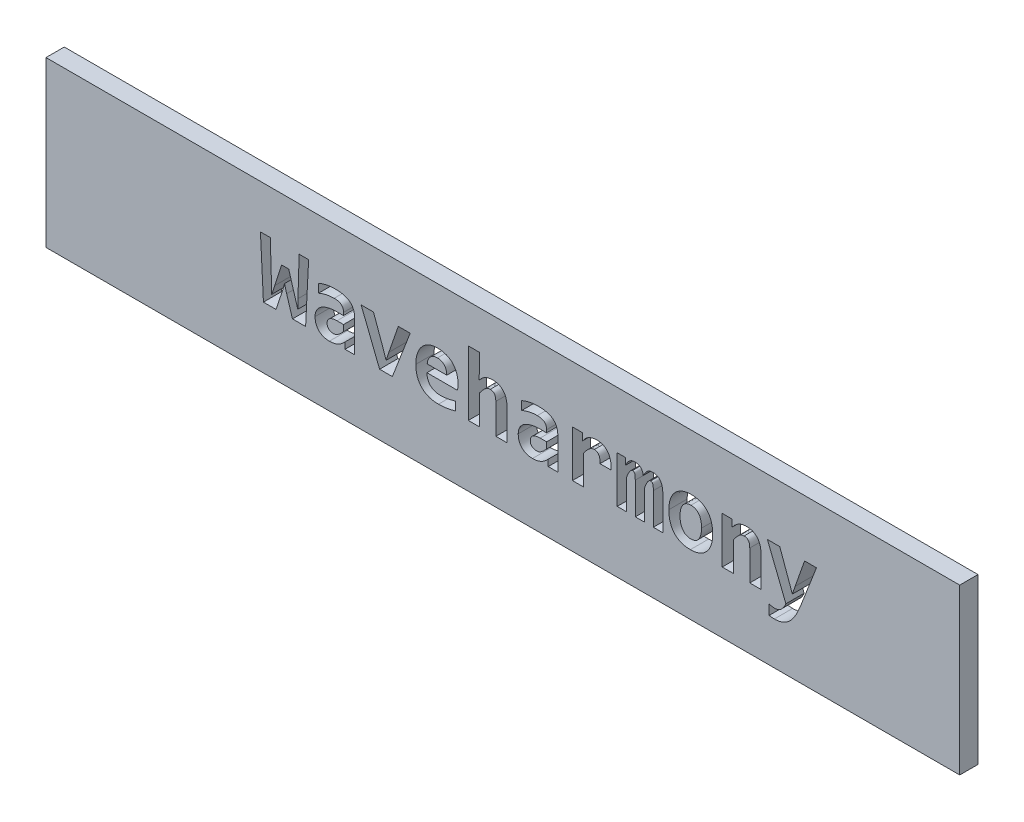
from build123d import *

# Parameters (mm, degrees)
SKETCH1_W           = 100
SKETCH1_H           = 18
BOSS_EXTRUDE1_DEPTH = 2
CUT_EXTRUDE1_DEPTH  = 2


with BuildPart() as part:
    # Sketch1 → Boss-Extrude1 (new body)
    with BuildSketch(Plane.XY):
        Rectangle(SKETCH1_W, SKETCH1_H)
    extrude(amount=BOSS_EXTRUDE1_DEPTH)

    # Sketch2 → Cut-Extrude1 (cut)
    # profile 1 of 11: a face of its own
    with BuildSketch(Plane.XY.offset(2)):
        Polygon((-21.587813536, -2.284890662), (-23.024407739, -2.284890662), (-23.663221145, -0.213898815), (-23.895784551, 0.629511512), (-24.140123319, -0.234505699), (-24.827510094, -2.284890662), (-26.203755565, -2.284890662), (-26.53346571, 4.215109338), (-25.454548138, 4.215109338), (-25.327962993, 0.048102997), (-25.295580746, -1.091163307), (-24.979117884, -0.110864394), (-24.207831652, 2.236848468), (-23.438017341, 2.236848468), (-22.685866072, -0.286022909), (-22.442999225, -1.080859865), (-22.426808101, -0.066706786), (-22.295807196, 4.215109338), (-21.258103391, 4.215109338), align=None)
    # profile 2 of 11: a face of its own
    with BuildSketch(Plane.XY.offset(2)):
        with BuildLine():
            Line((-17.269199406, -2.284890662), (-17.298637812, -1.61516693))
            add(Edge.make_bspline(
                [(-17.298637812, -1.61516693), (-17.351452018, -1.668846314), (-17.456720305, -1.775839055), (-17.62611479, -1.923633479), (-17.808206845, -2.056912646), (-18.007567405, -2.169080327), (-18.225570732, -2.259247172), (-18.461299031, -2.329439707), (-18.719577787, -2.370744059), (-18.898464373, -2.376239967), (-18.991346145, -2.379093561)],
                knots=[0, 0, 0, 0, 0.942751787, 1.87907519, 2.811864331, 3.763701556, 4.73586472, 5.760432521, 6.837168281, 8, 8, 8, 8], degree=3))
            add(Edge.make_bspline(
                [(-18.991346145, -2.379093561), (-19.053219082, -2.377601554), (-19.173884307, -2.374691826), (-19.348923144, -2.354461759), (-19.512660378, -2.319077971), (-19.664608269, -2.269142844), (-19.804343246, -2.205725689), (-19.93276168, -2.131498086), (-20.049059591, -2.045945001), (-20.154944448, -1.949868998), (-20.247018541, -1.841733772), (-20.329829424, -1.724945391), (-20.396477124, -1.59530188), (-20.454837748, -1.457017294), (-20.498134879, -1.30870534), (-20.528852434, -1.152521487), (-20.548699508, -0.989622268), (-20.550611634, -0.878283733), (-20.551581652, -0.821801894)],
                knots=[0, 0, 0, 0, 1.188820374, 2.318449472, 3.379888704, 4.402475042, 5.385577281, 6.32342832, 7.24738733, 8.154894716, 9.063967784, 9.97147517, 10.899274027, 11.85872107, 12.852031674, 13.861540196, 14.915163189, 16, 16, 16, 16], degree=3))
            add(Edge.make_bspline(
                [(-20.551581652, -0.821801894), (-20.550260247, -0.763260444), (-20.547655254, -0.647852984), (-20.515751564, -0.479451608), (-20.471276507, -0.316728977), (-20.404411778, -0.162020354), (-20.318227027, -0.01539808), (-20.214142102, 0.122201264), (-20.087623554, 0.246865644), (-19.943402219, 0.361908255), (-19.778314464, 0.464613133), (-19.595939435, 0.557536908), (-19.393636257, 0.636933519), (-19.172683768, 0.704171929), (-18.931854096, 0.759231501), (-18.670883228, 0.795916973), (-18.390290679, 0.82043638), (-18.196566245, 0.822657013), (-18.096418609, 0.82380499)],
                knots=[0, 0, 0, 0, 0.846334836, 1.668447797, 2.473381772, 3.284808262, 4.099802161, 4.930887555, 5.774685007, 6.664352488, 7.596475241, 8.584410062, 9.623785724, 10.738215398, 11.925463769, 13.196192477, 14.550545786, 16, 16, 16, 16], degree=3))
            Line((-18.096418609, 0.82380499), (-17.442886, 0.82380499))
            Line((-17.442886, 0.82380499), (-17.442886, 1.122604809))
            add(Edge.make_bspline(
                [(-17.442886, 1.122604809), (-17.445117476, 1.18320802), (-17.449420267, 1.300064731), (-17.491133289, 1.465973166), (-17.561623502, 1.613524408), (-17.650923172, 1.715044012), (-17.737883737, 1.780932573), (-17.811455069, 1.827590247), (-17.895815455, 1.864618589), (-17.988173641, 1.897464004), (-18.090348745, 1.92469543), (-18.203992326, 1.940572051), (-18.328190913, 1.953688828), (-18.414801606, 1.954050896), (-18.45998292, 1.954239772)],
                knots=[0, 0, 0, 0, 1.447721202, 2.79153421, 4.061974913, 5.326381525, 5.97912129, 6.669712629, 7.405140625, 8.177401359, 9.014479125, 9.929270305, 10.919783635, 12, 12, 12, 12], degree=3))
            add(Edge.make_bspline(
                [(-18.45998292, 1.954239772), (-18.533624448, 1.953235612), (-18.681157283, 1.951223885), (-18.901230959, 1.930933741), (-19.120578733, 1.900642706), (-19.409040536, 1.840637604), (-19.765872332, 1.745286472), (-20.038434724, 1.633395759), (-20.174770058, 1.577428178)],
                knots=[0, 0, 0, 0, 0.749590158, 1.5017228, 2.248461115, 3.002830009, 4.500819683, 6, 6, 6, 6], degree=3))
            Line((-20.174770058, 1.577428178), (-20.174770058, 2.519457164))
            add(Edge.make_bspline(
                [(-20.174770058, 2.519457164), (-20.112268594, 2.546230956), (-19.98427608, 2.60105919), (-19.781233084, 2.670617626), (-19.5655734, 2.736007315), (-19.33637827, 2.790881745), (-19.098501166, 2.838423593), (-18.853800481, 2.872452895), (-18.604529956, 2.891306366), (-18.436952653, 2.89460634), (-18.352532739, 2.896268758)],
                knots=[0, 0, 0, 0, 0.870643359, 1.78293153, 2.747244943, 3.756289436, 4.800212086, 5.853400504, 6.918614031, 8, 8, 8, 8], degree=3))
            add(Edge.make_bspline(
                [(-18.352532739, 2.896268758), (-18.262226113, 2.894679263), (-18.088271295, 2.89161747), (-17.836932485, 2.873268427), (-17.605746022, 2.839714782), (-17.393577641, 2.79274324), (-17.200205594, 2.73300098), (-17.02429921, 2.659170096), (-16.866843273, 2.571154064), (-16.726445381, 2.469987431), (-16.603291724, 2.356275314), (-16.497224294, 2.22841685), (-16.410465285, 2.085559887), (-16.339339651, 1.929917132), (-16.285415586, 1.760713839), (-16.245479628, 1.578494727), (-16.221936987, 1.382773084), (-16.219498941, 1.247782605), (-16.218248319, 1.17853778)],
                knots=[0, 0, 0, 0, 1.377759711, 2.653935252, 3.841633143, 4.938469235, 5.965914915, 6.92517161, 7.843396777, 8.711792949, 9.559226208, 10.39396998, 11.237393933, 12.101553923, 12.998669062, 13.941252007, 14.943942973, 16, 16, 16, 16], degree=3))
            Line((-16.218248319, 1.17853778), (-16.218248319, -2.284890662))
            Line((-16.218248319, -2.284890662), (-17.269199406, -2.284890662))
        make_face()
        with BuildLine():
            Line((-17.442886, -0.024021097), (-18.15235158, -0.024021097))
            add(Edge.make_bspline(
                [(-18.15235158, -0.024021097), (-18.199454486, -0.025160611), (-18.290339198, -0.027359294), (-18.421513086, -0.035892563), (-18.541204408, -0.057761637), (-18.650073709, -0.083509334), (-18.748897102, -0.115844723), (-18.83669797, -0.15574051), (-18.915971397, -0.199938492), (-19.006641327, -0.265154456), (-19.099128469, -0.361669291), (-19.178988621, -0.494472513), (-19.224474309, -0.641302171), (-19.229959336, -0.742508508), (-19.232741072, -0.793835409)],
                knots=[0, 0, 0, 0, 1.1346769, 2.18935077, 3.160455313, 4.060166297, 4.882052532, 5.659342063, 6.378819937, 7.064121245, 8.342468752, 9.566207994, 10.765699828, 12, 12, 12, 12], degree=3))
            add(Edge.make_bspline(
                [(-19.232741072, -0.793835409), (-19.230681756, -0.843111116), (-19.226750035, -0.937190042), (-19.191554696, -1.069905166), (-19.129830281, -1.182988214), (-19.045171415, -1.276936569), (-18.939065539, -1.348765651), (-18.815603584, -1.400882007), (-18.674923493, -1.431929436), (-18.575447769, -1.435297906), (-18.523275493, -1.437064575)],
                knots=[0, 0, 0, 0, 1.086697673, 2.074761695, 3.000659932, 3.905665256, 4.840141479, 5.805924735, 6.849267962, 8, 8, 8, 8], degree=3))
            add(Edge.make_bspline(
                [(-18.523275493, -1.437064575), (-18.482298101, -1.434710513), (-18.397916351, -1.429862966), (-18.271711857, -1.391240762), (-18.142157455, -1.33404858), (-18.012486333, -1.248839413), (-17.878998501, -1.142892279), (-17.737353681, -1.019264277), (-17.59015715, -0.874565064), (-17.493389032, -0.768325794), (-17.442886, -0.712879793)],
                knots=[0, 0, 0, 0, 0.735319699, 1.514190145, 2.354950119, 3.274773688, 4.292602642, 5.417493931, 6.652196731, 8, 8, 8, 8], degree=3))
            Line((-17.442886, -0.712879793), (-17.442886, -0.024021097))
        make_face(mode=Mode.SUBTRACT)
    # profile 3 of 11: a face of its own
    with BuildSketch(Plane.XY.offset(2)):
        Polygon((-12.093927667, -2.284890662), (-13.489308101, -2.284890662), (-15.51172658, 2.802065859), (-14.160503754, 2.802065859), (-13.097777304, -0.135887039), (-12.779842522, -1.083803706), (-12.478098862, -0.175628887), (-11.443338899, 2.802065859), (-10.142161362, 2.802065859), align=None)
    # profile 4 of 11: a face of its own
    with BuildSketch(Plane.XY.offset(2)):
        with BuildLine():
            add(Edge.make_bspline(
                [(-4.913900493, 0.666309519), (-4.914152692, 0.619202447), (-4.914725548, 0.512201219), (-4.92153346, 0.341483685), (-4.928107492, 0.15824209), (-4.939373307, 0.035311886), (-4.944810819, -0.024021097)],
                knots=[0, 0, 0, 0, 0.817723831, 1.857416531, 2.965869532, 4, 4, 4, 4], degree=3))
            Line((-4.944810819, -0.024021097), (-8.305204841, -0.024021097))
            add(Edge.make_bspline(
                [(-8.305204841, -0.024021097), (-8.304481883, -0.080045003), (-8.303074998, -0.189068328), (-8.280454883, -0.346767819), (-8.251478725, -0.495328752), (-8.205333905, -0.63231827), (-8.147034089, -0.758501764), (-8.08006244, -0.875098402), (-8.001153615, -0.980529041), (-7.91227442, -1.075247288), (-7.813536191, -1.159990439), (-7.703142428, -1.231436741), (-7.585717013, -1.295742357), (-7.457904186, -1.346545341), (-7.322840118, -1.388645887), (-7.179475998, -1.415104903), (-7.029556261, -1.434103831), (-6.927062102, -1.4360609), (-6.874498319, -1.437064575)],
                knots=[0, 0, 0, 0, 1.179290589, 2.294916396, 3.351295625, 4.364764696, 5.331602319, 6.276694144, 7.192669172, 8.099614974, 9.009032183, 9.926581103, 10.865546218, 11.825449834, 12.819647447, 13.841518478, 14.893030041, 16, 16, 16, 16], degree=3))
            add(Edge.make_bspline(
                [(-6.874498319, -1.437064575), (-6.745806527, -1.433825622), (-6.479180388, -1.427115096), (-6.142138262, -1.383196902), (-5.861376103, -1.333867673), (-5.642693007, -1.285202964), (-5.420659469, -1.224286153), (-5.271935679, -1.177953742), (-5.196509188, -1.15445588)],
                knots=[0, 0, 0, 0, 1.355541314, 2.808436665, 3.575023574, 4.358862549, 5.167683667, 6, 6, 6, 6], degree=3))
            Line((-5.196509188, -1.15445588), (-5.196509188, -2.096484865))
            add(Edge.make_bspline(
                [(-5.196509188, -2.096484865), (-5.264059726, -2.116674927), (-5.404702325, -2.158711348), (-5.624293956, -2.212104517), (-5.855513944, -2.257638753), (-6.092240303, -2.301151825), (-6.333144068, -2.336918894), (-6.575302851, -2.36124457), (-6.814925598, -2.376767615), (-6.973094128, -2.378325136), (-7.051128754, -2.379093561)],
                knots=[0, 0, 0, 0, 0.898776519, 1.871284374, 2.879703842, 3.90303, 4.9398418, 5.983668506, 7.005215048, 8, 8, 8, 8], degree=3))
            add(Edge.make_bspline(
                [(-7.051128754, -2.379093561), (-7.145433683, -2.377292945), (-7.329177594, -2.373784621), (-7.597274323, -2.341310133), (-7.851039404, -2.29312305), (-8.089101126, -2.220442988), (-8.310642526, -2.127884914), (-8.515352122, -2.015230444), (-8.703300706, -1.883949718), (-8.873680161, -1.733238129), (-9.025175367, -1.562085507), (-9.157503376, -1.371638085), (-9.271509591, -1.162418961), (-9.365953516, -0.934577491), (-9.439093706, -0.687808655), (-9.491557966, -0.42274398), (-9.524798306, -0.139184891), (-9.528128064, 0.056347525), (-9.529842522, 0.157025099)],
                knots=[0, 0, 0, 0, 1.121620277, 2.185367166, 3.208914926, 4.191382306, 5.14116652, 6.060889567, 6.966233761, 7.863618855, 8.76100395, 9.679262128, 10.617148408, 11.590729859, 12.60841723, 13.674324534, 14.802534302, 16, 16, 16, 16], degree=3))
            add(Edge.make_bspline(
                [(-9.529842522, 0.157025099), (-9.528091614, 0.257700492), (-9.52466562, 0.45469169), (-9.491212783, 0.742596956), (-9.438513083, 1.016314066), (-9.365613344, 1.275753801), (-9.270666627, 1.519102184), (-9.159740983, 1.745691122), (-9.030414217, 1.954589075), (-8.883025356, 2.144100565), (-8.719937307, 2.316796264), (-8.536750387, 2.464927712), (-8.340480027, 2.596819111), (-8.125502405, 2.703068035), (-7.89740549, 2.791185938), (-7.654740225, 2.85218151), (-7.399715523, 2.890253609), (-7.22544453, 2.89423615), (-7.13650013, 2.896268758)],
                knots=[0, 0, 0, 0, 1.180034156, 2.308968792, 3.393220884, 4.44579929, 5.46393457, 6.451895544, 7.400149152, 8.339143413, 9.262785816, 10.178384736, 11.095843329, 12.029766064, 12.983882541, 13.957808115, 14.957706464, 16, 16, 16, 16], degree=3))
            add(Edge.make_bspline(
                [(-7.13650013, 2.896268758), (-7.049081503, 2.894345589), (-6.878577537, 2.890594583), (-6.63044303, 2.859860631), (-6.398495213, 2.806534101), (-6.181775162, 2.734576401), (-5.982257901, 2.642877637), (-5.79749654, 2.537326807), (-5.631740442, 2.41232747), (-5.482545202, 2.271842791), (-5.349245478, 2.116796377), (-5.233739187, 1.946394882), (-5.136929473, 1.761212205), (-5.055724286, 1.563739738), (-4.992653664, 1.354133784), (-4.947420409, 1.133959045), (-4.918320462, 0.903576111), (-4.915391975, 0.746373157), (-4.913900493, 0.666309519)],
                knots=[0, 0, 0, 0, 1.178593255, 2.298764342, 3.364464973, 4.383380692, 5.372275211, 6.320955639, 7.247223129, 8.164610705, 9.079585451, 9.998951109, 10.93417802, 11.892522129, 12.874152535, 13.88107589, 14.920829619, 16, 16, 16, 16], degree=3))
        make_face()
        with BuildLine():
            add(Edge.make_bspline(
                [(-6.138538174, 0.82380499), (-6.138759995, 0.87044271), (-6.139188318, 0.960497414), (-6.152184426, 1.09121633), (-6.177271706, 1.212463675), (-6.212734605, 1.324738923), (-6.256643746, 1.427803775), (-6.308659852, 1.521372132), (-6.367172098, 1.605862746), (-6.434219537, 1.679683969), (-6.507198219, 1.745309043), (-6.585934786, 1.802419273), (-6.671012761, 1.850117828), (-6.791986671, 1.900987019), (-6.955327315, 1.946198024), (-7.091017163, 1.951528059), (-7.160050855, 1.954239772)],
                knots=[0, 0, 0, 0, 1.134846417, 2.191321935, 3.191481249, 4.143340004, 5.052899811, 5.913632381, 6.745287675, 7.548677924, 8.335201916, 9.130741839, 9.911440996, 10.703386864, 12.32281206, 14, 14, 14, 14], degree=3))
            add(Edge.make_bspline(
                [(-7.160050855, 1.954239772), (-7.198384499, 1.953614093), (-7.273389408, 1.952389867), (-7.382476475, 1.936316816), (-7.486798798, 1.9151484), (-7.586076448, 1.882527258), (-7.679613078, 1.839358684), (-7.769392367, 1.789753142), (-7.851818296, 1.728171709), (-7.956653347, 1.635927698), (-8.071499479, 1.497337347), (-8.174345983, 1.299121128), (-8.251584906, 1.072968071), (-8.273268829, 0.909310579), (-8.284597957, 0.82380499)],
                knots=[0, 0, 0, 0, 0.778791991, 1.523810857, 2.23806509, 2.941647734, 3.642679102, 4.330739894, 5.023199128, 5.729957914, 7.168361981, 8.650260572, 10.249872714, 12, 12, 12, 12], degree=3))
            Line((-8.284597957, 0.82380499), (-6.138538174, 0.82380499))
        make_face(mode=Mode.SUBTRACT)
    # profile 5 of 11: a face of its own
    with BuildSketch(Plane.XY.offset(2)):
        with BuildLine():
            Line((-0.768972957, -2.284890662), (-0.768972957, 1.02545807))
            add(Edge.make_bspline(
                [(-0.768972957, 1.02545807), (-0.770974521, 1.090805814), (-0.7747278, 1.213344082), (-0.801409345, 1.385238291), (-0.849258502, 1.530792764), (-0.915920356, 1.652192248), (-1.005318698, 1.746141073), (-1.113813324, 1.814341593), (-1.24285389, 1.853258774), (-1.334410625, 1.85769435), (-1.382763717, 1.860036874)],
                knots=[0, 0, 0, 0, 1.330337845, 2.494612452, 3.527515131, 4.435664575, 5.29056087, 6.138661007, 7.016986611, 8, 8, 8, 8], degree=3))
            add(Edge.make_bspline(
                [(-1.382763717, 1.860036874), (-1.433621911, 1.856669733), (-1.535882831, 1.849899398), (-1.687486099, 1.801512875), (-1.833237608, 1.720141707), (-1.975752342, 1.608561189), (-2.114808998, 1.46938508), (-2.262409591, 1.312145662), (-2.409286974, 1.128380589), (-2.507655389, 0.997742849), (-2.558828029, 0.929783251)],
                knots=[0, 0, 0, 0, 0.785464114, 1.579338109, 2.434441881, 3.353550729, 4.367060634, 5.472426257, 6.685120424, 8, 8, 8, 8], degree=3))
            Line((-2.558828029, 0.929783251), (-2.558828029, -2.284890662))
            Line((-2.558828029, -2.284890662), (-3.78346571, -2.284890662))
            Line((-3.78346571, -2.284890662), (-3.78346571, 4.780326729))
            Line((-3.78346571, 4.780326729), (-2.558828029, 4.780326729))
            Line((-2.558828029, 4.780326729), (-2.558828029, 3.036101185))
            Line((-2.558828029, 3.036101185), (-2.619176761, 2.113207164))
            add(Edge.make_bspline(
                [(-2.619176761, 2.113207164), (-2.567853881, 2.172214398), (-2.468025699, 2.286989422), (-2.309840964, 2.445355045), (-2.143133416, 2.582683398), (-1.963229523, 2.695610445), (-1.770157877, 2.785322231), (-1.560566608, 2.848351679), (-1.332867816, 2.889729142), (-1.173946195, 2.894031816), (-1.0913235, 2.896268758)],
                knots=[0, 0, 0, 0, 1.052065119, 2.046372823, 3.008332997, 3.951627659, 4.896837736, 5.863678464, 6.889335241, 8, 8, 8, 8], degree=3))
            add(Edge.make_bspline(
                [(-1.0913235, 2.896268758), (-1.028412933, 2.895261569), (-0.906466428, 2.893309223), (-0.730204644, 2.866659797), (-0.565851344, 2.828423593), (-0.414928484, 2.771232137), (-0.275035297, 2.702417903), (-0.148564736, 2.618051866), (-0.033190773, 2.521081609), (0.069561186, 2.410442341), (0.160636151, 2.287669409), (0.242018043, 2.154001066), (0.30672954, 2.00636172), (0.361508219, 1.848375018), (0.403879946, 1.679894342), (0.434824099, 1.501849768), (0.45240669, 1.313820711), (0.454560889, 1.185443072), (0.455664725, 1.119660968)],
                knots=[0, 0, 0, 0, 1.128292418, 2.187093889, 3.193297493, 4.152042544, 5.077728068, 5.986496946, 6.874059951, 7.777692081, 8.690209529, 9.614679004, 10.580558963, 11.577778426, 12.613878209, 13.695586306, 14.819193276, 16, 16, 16, 16], degree=3))
            Line((0.455664725, 1.119660968), (0.455664725, -2.284890662))
            Line((0.455664725, -2.284890662), (-0.768972957, -2.284890662))
        make_face()
    # profile 6 of 11: a face of its own
    with BuildSketch(Plane.XY.offset(2)):
        with BuildLine():
            Line((4.962684652, -2.284890662), (4.933246246, -1.61516693))
            add(Edge.make_bspline(
                [(4.933246246, -1.61516693), (4.88043204, -1.668846314), (4.775163753, -1.775839055), (4.605769268, -1.923633479), (4.423677213, -2.056912646), (4.224316653, -2.169080327), (4.006313325, -2.259247172), (3.770585027, -2.329439707), (3.512306271, -2.370744059), (3.333419685, -2.376239967), (3.240537913, -2.379093561)],
                knots=[0, 0, 0, 0, 0.942751787, 1.87907519, 2.811864331, 3.763701556, 4.73586472, 5.760432521, 6.837168281, 8, 8, 8, 8], degree=3))
            add(Edge.make_bspline(
                [(3.240537913, -2.379093561), (3.178664976, -2.377601554), (3.057999751, -2.374691826), (2.882960914, -2.354461759), (2.71922368, -2.319077971), (2.567275789, -2.269142844), (2.427540811, -2.205725689), (2.299122378, -2.131498086), (2.182824467, -2.045945001), (2.07693961, -1.949868998), (1.984865517, -1.841733772), (1.902054634, -1.724945391), (1.835406934, -1.59530188), (1.77704631, -1.457017294), (1.733749179, -1.30870534), (1.703031624, -1.152521487), (1.68318455, -0.989622268), (1.681272424, -0.878283733), (1.680302406, -0.821801894)],
                knots=[0, 0, 0, 0, 1.188820374, 2.318449472, 3.379888704, 4.402475042, 5.385577281, 6.32342832, 7.24738733, 8.154894716, 9.063967784, 9.97147517, 10.899274027, 11.85872107, 12.852031674, 13.861540196, 14.915163189, 16, 16, 16, 16], degree=3))
            add(Edge.make_bspline(
                [(1.680302406, -0.821801894), (1.681623811, -0.763260444), (1.684228804, -0.647852984), (1.716132494, -0.479451608), (1.760607551, -0.316728977), (1.82747228, -0.162020354), (1.913657031, -0.01539808), (2.017741956, 0.122201264), (2.144260504, 0.246865644), (2.288481839, 0.361908255), (2.453569594, 0.464613133), (2.635944623, 0.557536908), (2.838247801, 0.636933519), (3.05920029, 0.704171929), (3.300029962, 0.759231501), (3.56100083, 0.795916973), (3.841593379, 0.82043638), (4.035317813, 0.822657013), (4.135465449, 0.82380499)],
                knots=[0, 0, 0, 0, 0.846334836, 1.668447797, 2.473381772, 3.284808262, 4.099802161, 4.930887555, 5.774685007, 6.664352488, 7.596475241, 8.584410062, 9.623785724, 10.738215398, 11.925463769, 13.196192477, 14.550545786, 16, 16, 16, 16], degree=3))
            Line((4.135465449, 0.82380499), (4.788998058, 0.82380499))
            Line((4.788998058, 0.82380499), (4.788998058, 1.122604809))
            add(Edge.make_bspline(
                [(4.788998058, 1.122604809), (4.786766582, 1.18320802), (4.782463791, 1.300064731), (4.740750769, 1.465973166), (4.670260556, 1.613524408), (4.580960886, 1.715044012), (4.494000321, 1.780932573), (4.420428989, 1.827590247), (4.336068603, 1.864618589), (4.243710417, 1.897464004), (4.141535313, 1.92469543), (4.027891732, 1.940572051), (3.903693145, 1.953688828), (3.817082452, 1.954050896), (3.771901138, 1.954239772)],
                knots=[0, 0, 0, 0, 1.447721202, 2.79153421, 4.061974913, 5.326381525, 5.97912129, 6.669712629, 7.405140625, 8.177401359, 9.014479125, 9.929270305, 10.919783635, 12, 12, 12, 12], degree=3))
            add(Edge.make_bspline(
                [(3.771901138, 1.954239772), (3.69825961, 1.953235612), (3.550726775, 1.951223885), (3.330653099, 1.930933741), (3.111305325, 1.900642706), (2.822843522, 1.840637604), (2.466011726, 1.745286472), (2.193449334, 1.633395759), (2.057114, 1.577428178)],
                knots=[0, 0, 0, 0, 0.749590158, 1.5017228, 2.248461115, 3.002830009, 4.500819683, 6, 6, 6, 6], degree=3))
            Line((2.057114, 1.577428178), (2.057114, 2.519457164))
            add(Edge.make_bspline(
                [(2.057114, 2.519457164), (2.119615464, 2.546230956), (2.247607978, 2.60105919), (2.450650974, 2.670617626), (2.666310658, 2.736007315), (2.895505788, 2.790881745), (3.133382892, 2.838423593), (3.378083577, 2.872452895), (3.627354102, 2.891306366), (3.794931405, 2.89460634), (3.879351319, 2.896268758)],
                knots=[0, 0, 0, 0, 0.870643359, 1.78293153, 2.747244943, 3.756289436, 4.800212086, 5.853400504, 6.918614031, 8, 8, 8, 8], degree=3))
            add(Edge.make_bspline(
                [(3.879351319, 2.896268758), (3.969657945, 2.894679263), (4.143612763, 2.89161747), (4.394951573, 2.873268427), (4.626138036, 2.839714782), (4.838306417, 2.79274324), (5.031678464, 2.73300098), (5.207584848, 2.659170096), (5.365040785, 2.571154064), (5.505438677, 2.469987431), (5.628592334, 2.356275314), (5.734659764, 2.22841685), (5.821418773, 2.085559887), (5.892544407, 1.929917132), (5.946468472, 1.760713839), (5.98640443, 1.578494727), (6.009947071, 1.382773084), (6.012385117, 1.247782605), (6.013635739, 1.17853778)],
                knots=[0, 0, 0, 0, 1.377759711, 2.653935252, 3.841633143, 4.938469235, 5.965914915, 6.92517161, 7.843396777, 8.711792949, 9.559226208, 10.39396998, 11.237393933, 12.101553923, 12.998669062, 13.941252007, 14.943942973, 16, 16, 16, 16], degree=3))
            Line((6.013635739, 1.17853778), (6.013635739, -2.284890662))
            Line((6.013635739, -2.284890662), (4.962684652, -2.284890662))
        make_face()
        with BuildLine():
            Line((4.788998058, -0.024021097), (4.079532478, -0.024021097))
            add(Edge.make_bspline(
                [(4.079532478, -0.024021097), (4.032429572, -0.025160611), (3.94154486, -0.027359294), (3.810370972, -0.035892563), (3.69067965, -0.057761637), (3.581810349, -0.083509334), (3.482986956, -0.115844723), (3.395186088, -0.15574051), (3.315912661, -0.199938492), (3.225242731, -0.265154456), (3.132755589, -0.361669291), (3.052895437, -0.494472513), (3.007409749, -0.641302171), (3.001924722, -0.742508508), (2.999142986, -0.793835409)],
                knots=[0, 0, 0, 0, 1.1346769, 2.18935077, 3.160455313, 4.060166297, 4.882052532, 5.659342063, 6.378819937, 7.064121245, 8.342468752, 9.566207994, 10.765699828, 12, 12, 12, 12], degree=3))
            add(Edge.make_bspline(
                [(2.999142986, -0.793835409), (3.001202302, -0.843111116), (3.005134023, -0.937190042), (3.040329362, -1.069905166), (3.102053777, -1.182988214), (3.186712643, -1.276936569), (3.292818519, -1.348765651), (3.416280474, -1.400882007), (3.556960565, -1.431929436), (3.656436289, -1.435297906), (3.708608565, -1.437064575)],
                knots=[0, 0, 0, 0, 1.086697673, 2.074761695, 3.000659932, 3.905665256, 4.840141479, 5.805924735, 6.849267962, 8, 8, 8, 8], degree=3))
            add(Edge.make_bspline(
                [(3.708608565, -1.437064575), (3.749585957, -1.434710513), (3.833967707, -1.429862966), (3.960172201, -1.391240762), (4.089726603, -1.33404858), (4.219397724, -1.248839413), (4.352885557, -1.142892279), (4.494530377, -1.019264277), (4.641726908, -0.874565064), (4.738495026, -0.768325794), (4.788998058, -0.712879793)],
                knots=[0, 0, 0, 0, 0.735319699, 1.514190145, 2.354950119, 3.274773688, 4.292602642, 5.417493931, 6.652196731, 8, 8, 8, 8], degree=3))
            Line((4.788998058, -0.712879793), (4.788998058, -0.024021097))
        make_face(mode=Mode.SUBTRACT)
    # profile 7 of 11: a face of its own
    with BuildSketch(Plane.XY.offset(2)):
        with BuildLine():
            add(Edge.make_bspline(
                [(10.629577768, 0.82380499), (10.630329574, 0.868449404), (10.63176725, 0.953822808), (10.629705572, 1.077186508), (10.619501224, 1.189811969), (10.598250684, 1.321724532), (10.562933911, 1.467512371), (10.492189992, 1.614532609), (10.400829964, 1.72965893), (10.286018922, 1.806253455), (10.154634783, 1.852677436), (10.061325384, 1.857520492), (10.012843167, 1.860036874)],
                knots=[0, 0, 0, 0, 0.976776958, 1.86788822, 2.697749972, 3.447690252, 4.791052046, 5.96229558, 6.991616706, 7.96508575, 8.942687937, 10, 10, 10, 10], degree=3))
            add(Edge.make_bspline(
                [(10.012843167, 1.860036874), (9.967908399, 1.857426208), (9.875247928, 1.852042725), (9.736636801, 1.807797451), (9.597449076, 1.736518127), (9.453692485, 1.63966404), (9.309210655, 1.507384634), (9.155388351, 1.345163435), (8.997308597, 1.144902759), (8.894320682, 0.996619001), (8.839722696, 0.918007888)],
                knots=[0, 0, 0, 0, 0.690160971, 1.42318841, 2.216380134, 3.091386283, 4.08043663, 5.222959024, 6.527780232, 8, 8, 8, 8], degree=3))
            Line((8.839722696, 0.918007888), (8.839722696, -2.284890662))
            Line((8.839722696, -2.284890662), (7.615085014, -2.284890662))
            Line((7.615085014, -2.284890662), (7.615085014, 2.802065859))
            Line((7.615085014, 2.802065859), (8.696946428, 2.802065859))
            Line((8.696946428, 2.802065859), (8.741104036, 2.048442671))
            add(Edge.make_bspline(
                [(8.741104036, 2.048442671), (8.783968874, 2.110753685), (8.868618055, 2.233805037), (9.017207576, 2.39996838), (9.182802577, 2.545545499), (9.367434967, 2.668473608), (9.570115383, 2.770647072), (9.795730212, 2.841545663), (10.041757787, 2.889282312), (10.213762103, 2.893885575), (10.302811464, 2.896268758)],
                knots=[0, 0, 0, 0, 0.974824238, 1.925076027, 2.866944946, 3.811298368, 4.779277887, 5.783987857, 6.852735393, 8, 8, 8, 8], degree=3))
            add(Edge.make_bspline(
                [(10.302811464, 2.896268758), (10.364685354, 2.894347865), (10.484968699, 2.890613635), (10.660639841, 2.868108797), (10.824379311, 2.824084274), (10.978555231, 2.767592491), (11.121207927, 2.692957176), (11.252353445, 2.603289723), (11.372146683, 2.49748176), (11.477598344, 2.374266539), (11.572813887, 2.23665199), (11.654066319, 2.081920234), (11.721275116, 1.910472167), (11.775531668, 1.722683814), (11.816112482, 1.519290036), (11.844086098, 1.300960305), (11.857015517, 1.067316747), (11.855169012, 0.906732908), (11.854215449, 0.82380499)],
                knots=[0, 0, 0, 0, 1.004676022, 1.953098346, 2.866842467, 3.75148626, 4.613577702, 5.472942283, 6.324856067, 7.199983409, 8.099136356, 9.036153176, 10.030037521, 11.083594088, 12.205103978, 13.393537797, 14.653983583, 16, 16, 16, 16], degree=3))
            Line((11.854215449, 0.82380499), (10.629577768, 0.82380499))
        make_face()
    # profile 8 of 11: a face of its own
    with BuildSketch(Plane.XY.offset(2)):
        with BuildLine():
            Line((16.470157478, -2.284890662), (16.470157478, 1.190313142))
            add(Edge.make_bspline(
                [(16.470157478, 1.190313142), (16.469511995, 1.250180542), (16.468310418, 1.361624619), (16.461767756, 1.516876449), (16.448633409, 1.648749097), (16.424625645, 1.757544049), (16.389748706, 1.84537017), (16.335184781, 1.908903301), (16.261337143, 1.950091329), (16.204829778, 1.952784681), (16.1743015, 1.954239772)],
                knots=[0, 0, 0, 0, 1.57207779, 2.926446748, 4.080351894, 5.046061874, 5.847990396, 6.532792488, 7.207336622, 8, 8, 8, 8], degree=3))
            add(Edge.make_bspline(
                [(16.1743015, 1.954239772), (16.148319556, 1.951455397), (16.093490925, 1.945579644), (16.014932967, 1.900822835), (15.93811981, 1.832590886), (15.860760022, 1.736808767), (15.782558779, 1.609802132), (15.700643962, 1.448058864), (15.615176861, 1.249239336), (15.558549628, 1.103663787), (15.528128493, 1.02545807)],
                knots=[0, 0, 0, 0, 0.526386392, 1.110811622, 1.796736747, 2.611539741, 3.602236173, 4.824552589, 6.294094422, 8, 8, 8, 8], degree=3))
            Line((15.528128493, 1.02545807), (15.528128493, -2.284890662))
            Line((15.528128493, -2.284890662), (14.491896609, -2.284890662))
            Line((14.491896609, -2.284890662), (14.491896609, 1.190313142))
            add(Edge.make_bspline(
                [(14.491896609, 1.190313142), (14.491252463, 1.250181618), (14.490053375, 1.361627697), (14.483494802, 1.516866727), (14.470408029, 1.648777651), (14.446263232, 1.757462352), (14.411658728, 1.845911777), (14.355231658, 1.908965896), (14.28050993, 1.949848117), (14.223604284, 1.952707069), (14.19309679, 1.954239772)],
                knots=[0, 0, 0, 0, 1.56817695, 2.919185273, 4.070227203, 5.033540939, 5.833479614, 6.525113343, 7.209303479, 8, 8, 8, 8], degree=3))
            add(Edge.make_bspline(
                [(14.19309679, 1.954239772), (14.17055354, 1.951237676), (14.120956785, 1.94463285), (14.04923641, 1.899222331), (13.974378062, 1.831934852), (13.895597609, 1.736683071), (13.814556262, 1.609716616), (13.727697034, 1.44870427), (13.639838686, 1.249282525), (13.58129936, 1.103652004), (13.549867623, 1.02545807)],
                knots=[0, 0, 0, 0, 0.461467236, 1.015260787, 1.699195272, 2.527065893, 3.536698797, 4.783036028, 6.272703641, 8, 8, 8, 8], degree=3))
            Line((13.549867623, 1.02545807), (13.549867623, -2.284890662))
            Line((13.549867623, -2.284890662), (12.513635739, -2.284890662))
            Line((12.513635739, -2.284890662), (12.513635739, 2.802065859))
            Line((12.513635739, 2.802065859), (13.402675594, 2.802065859))
            Line((13.402675594, 2.802065859), (13.421810558, 2.061689954))
            add(Edge.make_bspline(
                [(13.421810558, 2.061689954), (13.457135503, 2.131396231), (13.523546828, 2.262444874), (13.632359569, 2.440150912), (13.746462085, 2.587311347), (13.867347919, 2.705779976), (13.997666095, 2.795219812), (14.139164708, 2.855881301), (14.294508656, 2.889891909), (14.402918302, 2.894081533), (14.459514362, 2.896268758)],
                knots=[0, 0, 0, 0, 1.320063528, 2.481735381, 3.514909617, 4.458823029, 5.330242051, 6.169482956, 7.044365, 8, 8, 8, 8], degree=3))
            add(Edge.make_bspline(
                [(14.459514362, 2.896268758), (14.525983049, 2.894137777), (14.65203128, 2.89009668), (14.828777049, 2.849050759), (14.980829512, 2.778975141), (15.106560681, 2.679930637), (15.206821102, 2.556151272), (15.282729183, 2.410628027), (15.332818849, 2.243159958), (15.34606798, 2.123845558), (15.352969978, 2.061689954)],
                knots=[0, 0, 0, 0, 1.159249387, 2.198348458, 3.145065495, 4.060360364, 4.967639778, 5.906609633, 6.90946991, 8, 8, 8, 8], degree=3))
            add(Edge.make_bspline(
                [(15.352969978, 2.061689954), (15.391880095, 2.131347823), (15.464968614, 2.262192726), (15.580948806, 2.440341805), (15.701179016, 2.586696439), (15.824994838, 2.705985821), (15.958711438, 2.795686954), (16.104336722, 2.8558302), (16.263011593, 2.889674394), (16.373336492, 2.894020302), (16.43041563, 2.896268758)],
                knots=[0, 0, 0, 0, 1.322809137, 2.484756373, 3.519035809, 4.457087715, 5.325729174, 6.171754522, 7.054114906, 8, 8, 8, 8], degree=3))
            add(Edge.make_bspline(
                [(16.43041563, 2.896268758), (16.474622609, 2.89514229), (16.560953054, 2.892942445), (16.686097153, 2.875774694), (16.802043927, 2.844431028), (16.909005055, 2.801789668), (17.00688099, 2.746778256), (17.09659704, 2.680580108), (17.174625407, 2.599162117), (17.245862659, 2.507793074), (17.307338675, 2.404122802), (17.360735941, 2.289143719), (17.40596278, 2.163012467), (17.442553342, 2.024534368), (17.471806983, 1.87509751), (17.492198574, 1.71381234), (17.503647206, 1.541288593), (17.505455994, 1.422403032), (17.506389362, 1.361055896)],
                knots=[0, 0, 0, 0, 0.994382016, 1.941897946, 2.833502956, 3.690266084, 4.525426665, 5.353261134, 6.188421714, 7.053886041, 7.954937794, 8.893150193, 9.90218801, 10.965145234, 12.112438725, 13.325441447, 14.619878582, 16, 16, 16, 16], degree=3))
            Line((17.506389362, 1.361055896), (17.506389362, -2.284890662))
            Line((17.506389362, -2.284890662), (16.470157478, -2.284890662))
        make_face()
    # profile 9 of 11: a face of its own
    with BuildSketch(Plane.XY.offset(2)):
        with BuildLine():
            add(Edge.make_bspline(
                [(22.970157478, 0.301273287), (22.96825055, 0.203556287), (22.964522499, 0.012519284), (22.933155307, -0.268214249), (22.880089135, -0.535315751), (22.808674845, -0.789910827), (22.715656201, -1.028064678), (22.605569148, -1.250593674), (22.475197494, -1.454422328), (22.327906384, -1.641034524), (22.161880781, -1.808206216), (21.978513564, -1.957012546), (21.775038845, -2.083200343), (21.555807852, -2.191566357), (21.318983364, -2.27514459), (21.06646695, -2.335424394), (20.798246968, -2.373087298), (20.613739654, -2.377061664), (20.519410196, -2.379093561)],
                knots=[0, 0, 0, 0, 1.143405147, 2.235360214, 3.30068978, 4.327645514, 5.32574877, 6.288745501, 7.228574177, 8.15226604, 9.065853977, 9.980578095, 10.909413832, 11.862169745, 12.837482556, 13.841645956, 14.896540392, 16, 16, 16, 16], degree=3))
            add(Edge.make_bspline(
                [(20.519410196, -2.379093561), (20.429519827, -2.377268704), (20.254089906, -2.373707317), (19.998659261, -2.341526361), (19.757178392, -2.292891133), (19.531209976, -2.220532409), (19.321193976, -2.127389301), (19.126560397, -2.015271219), (18.948797442, -1.881714728), (18.787244531, -1.727976339), (18.644287948, -1.552944142), (18.517741629, -1.358319245), (18.4111781, -1.142466293), (18.320851337, -0.9071331), (18.250363575, -0.651337047), (18.201026967, -0.374946455), (18.171698764, -0.078626516), (18.167810447, 0.125555847), (18.165809652, 0.230621113)],
                knots=[0, 0, 0, 0, 1.077189545, 2.102241659, 3.081639916, 4.026608894, 4.940362715, 5.831186608, 6.71348362, 7.599634715, 8.498115595, 9.416646629, 10.376779662, 11.378479316, 12.43450362, 13.552466741, 14.740583038, 16, 16, 16, 16], degree=3))
            add(Edge.make_bspline(
                [(18.165809652, 0.230621113), (18.16750145, 0.328856878), (18.170810203, 0.520982653), (18.205093868, 0.801784527), (18.255155051, 1.069564611), (18.328762775, 1.322891315), (18.423091081, 1.560150326), (18.535205775, 1.780556993), (18.664493832, 1.983878111), (18.814783294, 2.166947068), (18.98096344, 2.333651575), (19.167905704, 2.477048159), (19.369822479, 2.604093537), (19.589442887, 2.709847026), (19.825331091, 2.793564748), (20.076254613, 2.854390983), (20.341765141, 2.88971045), (20.523720292, 2.894053076), (20.616556935, 2.896268758)],
                knots=[0, 0, 0, 0, 1.152928624, 2.254853983, 3.316932465, 4.348863888, 5.347001052, 6.310624047, 7.248695715, 8.170060024, 9.086656943, 10.00627247, 10.930226806, 11.883600043, 12.862125132, 13.863996206, 14.910174177, 16, 16, 16, 16], degree=3))
            add(Edge.make_bspline(
                [(20.616556935, 2.896268758), (20.706917325, 2.894348652), (20.883285077, 2.890600939), (21.140664132, 2.859708881), (21.382355136, 2.806423475), (21.60922729, 2.734993172), (21.819771677, 2.64129159), (22.014961081, 2.528851986), (22.191768595, 2.392451507), (22.352709507, 2.237881232), (22.496584452, 2.062601795), (22.621989469, 1.867492788), (22.727780665, 1.652276671), (22.816405148, 1.418796519), (22.885092987, 1.165839072), (22.934846755, 0.894608738), (22.964336071, 0.604158385), (22.96817583, 0.404377525), (22.970157478, 0.301273287)],
                knots=[0, 0, 0, 0, 1.087326439, 2.122271921, 3.113768038, 4.062453131, 4.979800311, 5.882200991, 6.766825267, 7.660547789, 8.562561968, 9.489664413, 10.445654304, 11.443670493, 12.490891629, 13.595826129, 14.759237927, 16, 16, 16, 16], degree=3))
        make_face()
        with BuildLine():
            add(Edge.make_bspline(
                [(21.745519797, 0.271834881), (21.744918835, 0.335658105), (21.743752151, 0.459561844), (21.727721125, 0.639242585), (21.707155269, 0.807164735), (21.674856214, 0.962818307), (21.631834806, 1.105170409), (21.582479104, 1.236468617), (21.521678403, 1.354603349), (21.45239332, 1.461367128), (21.374399457, 1.556267591), (21.28692335, 1.638109973), (21.19001865, 1.706326264), (21.084673704, 1.762480518), (20.970717484, 1.807208041), (20.847412383, 1.837286861), (20.715833627, 1.857353081), (20.624977154, 1.859125861), (20.578287007, 1.860036874)],
                knots=[0, 0, 0, 0, 1.365763449, 2.651436101, 3.859107209, 4.985877321, 6.049232759, 7.040091003, 7.984258569, 8.887339926, 9.760107023, 10.607282846, 11.443646979, 12.289454445, 13.157405189, 14.056630476, 15.001323666, 16, 16, 16, 16], degree=3))
            add(Edge.make_bspline(
                [(20.578287007, 1.860036874), (20.527163323, 1.858837334), (20.428252799, 1.856516549), (20.285734505, 1.832624375), (20.155025919, 1.793008479), (20.036250622, 1.737593265), (19.927531507, 1.67030648), (19.832143924, 1.586909078), (19.741839646, 1.496724723), (19.666882799, 1.390593595), (19.598284947, 1.277471167), (19.541032505, 1.15380151), (19.492242315, 1.021506868), (19.441831213, 0.830587223), (19.398803807, 0.576407197), (19.393278273, 0.368202543), (19.390447333, 0.261531439)],
                knots=[0, 0, 0, 0, 0.953879595, 1.845499451, 2.688790498, 3.496288483, 4.286769123, 5.066828909, 5.857256459, 6.663506218, 7.485222534, 8.325372637, 9.203571786, 10.114744992, 12.009437186, 14, 14, 14, 14], degree=3))
            add(Edge.make_bspline(
                [(19.390447333, 0.261531439), (19.390889635, 0.19720249), (19.391748775, 0.072247916), (19.409970634, -0.108799514), (19.431036699, -0.278547066), (19.467854528, -0.43501015), (19.510093002, -0.580354558), (19.567729933, -0.711208437), (19.629899006, -0.832626593), (19.705551993, -0.939297318), (19.788435343, -1.03505284), (19.879754242, -1.117060758), (19.977818321, -1.187997973), (20.084522861, -1.243182258), (20.197359981, -1.28797924), (20.317702691, -1.320634033), (20.44567659, -1.339892207), (20.533572685, -1.341860414), (20.578287007, -1.342861677)],
                knots=[0, 0, 0, 0, 1.365781951, 2.652937826, 3.86313818, 4.995950441, 6.064202105, 7.072874446, 8.028734295, 8.956915597, 9.843306785, 10.714117838, 11.558644931, 12.407214536, 13.258851269, 14.133707562, 15.050583519, 16, 16, 16, 16], degree=3))
            add(Edge.make_bspline(
                [(20.578287007, -1.342861677), (20.627464135, -1.3417199), (20.722506031, -1.339513251), (20.859819622, -1.314764283), (20.987064625, -1.276969613), (21.104769761, -1.223855909), (21.210858381, -1.154688528), (21.308811998, -1.076318564), (21.393304749, -0.982704135), (21.468254978, -0.879294792), (21.535095767, -0.76572415), (21.59018241, -0.640660811), (21.639473226, -0.507309514), (21.689727466, -0.312716599), (21.736494153, -0.052617537), (21.7424555, 0.161680002), (21.745519797, 0.271834881)],
                knots=[0, 0, 0, 0, 0.918148327, 1.774454154, 2.598328981, 3.39443318, 4.177920706, 4.959904211, 5.732203502, 6.526404155, 7.344234932, 8.18966973, 9.077317062, 9.998208867, 11.942968355, 14, 14, 14, 14], degree=3))
        make_face(mode=Mode.SUBTRACT)
    # profile 10 of 11: a face of its own
    with BuildSketch(Plane.XY.offset(2)):
        with BuildLine():
            Line((27.020882116, -2.284890662), (27.020882116, 1.02545807))
            add(Edge.make_bspline(
                [(27.020882116, 1.02545807), (27.018880551, 1.090805814), (27.015127273, 1.213344082), (26.988445728, 1.385238291), (26.940596571, 1.530792764), (26.873934716, 1.652192248), (26.784536374, 1.746141073), (26.676041749, 1.814341593), (26.547001183, 1.853258774), (26.455444448, 1.85769435), (26.407091355, 1.860036874)],
                knots=[0, 0, 0, 0, 1.330337845, 2.494612452, 3.527515131, 4.435664575, 5.29056087, 6.138661007, 7.016986611, 8, 8, 8, 8], degree=3))
            add(Edge.make_bspline(
                [(26.407091355, 1.860036874), (26.356233162, 1.856669733), (26.253972242, 1.849899398), (26.102368974, 1.801512875), (25.956617465, 1.720141707), (25.81410273, 1.608561189), (25.675046074, 1.46938508), (25.527445481, 1.312145662), (25.380568098, 1.128380589), (25.282199683, 0.997742849), (25.231027043, 0.929783251)],
                knots=[0, 0, 0, 0, 0.785464114, 1.579338109, 2.434441881, 3.353550729, 4.367060634, 5.472426257, 6.685120424, 8, 8, 8, 8], degree=3))
            Line((25.231027043, 0.929783251), (25.231027043, -2.284890662))
            Line((25.231027043, -2.284890662), (24.006389362, -2.284890662))
            Line((24.006389362, -2.284890662), (24.006389362, 2.802065859))
            Line((24.006389362, 2.802065859), (25.067643891, 2.802065859))
            Line((25.067643891, 2.802065859), (25.097082297, 2.051386512))
            add(Edge.make_bspline(
                [(25.097082297, 2.051386512), (25.148839221, 2.112877782), (25.250651311, 2.233838503), (25.413862166, 2.401442709), (25.587972482, 2.548913062), (25.776273223, 2.672566243), (25.979804786, 2.770132346), (26.199364225, 2.843688688), (26.441058857, 2.889070241), (26.610005491, 2.893793713), (26.698531572, 2.896268758)],
                knots=[0, 0, 0, 0, 1.024448882, 2.015214114, 2.978651595, 3.927625391, 4.878802298, 5.848009221, 6.87238172, 8, 8, 8, 8], degree=3))
            add(Edge.make_bspline(
                [(26.698531572, 2.896268758), (26.76144214, 2.895261569), (26.883388644, 2.893309223), (27.059650429, 2.866659797), (27.224003728, 2.828423593), (27.374926589, 2.771232137), (27.514819775, 2.702417903), (27.641290336, 2.618051866), (27.756664299, 2.521081609), (27.859416259, 2.410442341), (27.950491223, 2.287669409), (28.031873115, 2.154001066), (28.096584612, 2.00636172), (28.151363291, 1.848375018), (28.193735018, 1.679894342), (28.224679172, 1.501849768), (28.242261762, 1.313820711), (28.244415962, 1.185443072), (28.245519797, 1.119660968)],
                knots=[0, 0, 0, 0, 1.128292418, 2.187093889, 3.193297493, 4.152042544, 5.077728068, 5.986496946, 6.874059951, 7.777692081, 8.690209529, 9.614679004, 10.580558963, 11.577778426, 12.613878209, 13.695586306, 14.819193276, 16, 16, 16, 16], degree=3))
            Line((28.245519797, 1.119660968), (28.245519797, -2.284890662))
            Line((28.245519797, -2.284890662), (27.020882116, -2.284890662))
        make_face()
    # profile 11 of 11: a face of its own
    with BuildSketch(Plane.XY.offset(2)):
        with BuildLine():
            add(Edge.make_bspline(
                [(32.57885313, -1.687291025), (32.535848076, -1.793547023), (32.451891184, -2.000985975), (32.3176462, -2.300590212), (32.179518382, -2.581330404), (32.038824834, -2.843723527), (31.893477412, -3.086467097), (31.740613935, -3.307286867), (31.580822882, -3.507967285), (31.413479546, -3.687604519), (31.237738729, -3.847194718), (31.050440055, -3.982998135), (30.854924027, -4.099992595), (30.648793059, -4.195172973), (30.431297963, -4.267160887), (30.202406575, -4.32072005), (29.960171838, -4.35159443), (29.794557153, -4.355408799), (29.710080486, -4.35735443)],
                knots=[0, 0, 0, 0, 1.307169413, 2.551929843, 3.743055619, 4.874644578, 5.946515101, 6.967815435, 7.935163439, 8.869435651, 9.764866054, 10.637811964, 11.503374392, 12.359608798, 13.221310446, 14.111674204, 15.036803585, 16, 16, 16, 16], degree=3))
            add(Edge.make_bspline(
                [(29.710080486, -4.35735443), (29.66688422, -4.356845552), (29.576451847, -4.355780203), (29.437054728, -4.34453087), (29.290211164, -4.328839859), (29.190931775, -4.313591265), (29.140447333, -4.30583722)],
                knots=[0, 0, 0, 0, 0.905194132, 1.895044698, 2.929611734, 4, 4, 4, 4], degree=3))
            Line((29.140447333, -4.30583722), (29.140447333, -3.226919648))
            add(Edge.make_bspline(
                [(29.140447333, -3.226919648), (29.161565573, -3.232238374), (29.206804581, -3.243632026), (29.277451119, -3.263231903), (29.354834031, -3.281092117), (29.437053417, -3.293935676), (29.521722134, -3.303046838), (29.606313917, -3.314638026), (29.688899326, -3.320387035), (29.742946924, -3.320883583), (29.768957297, -3.321122546)],
                knots=[0, 0, 0, 0, 0.819791631, 1.756138858, 2.759834621, 3.807435604, 4.886478007, 5.96552041, 7.020907943, 8, 8, 8, 8], degree=3))
            add(Edge.make_bspline(
                [(29.768957297, -3.321122546), (29.836150152, -3.317723562), (29.967743696, -3.311066838), (30.15625574, -3.249930989), (30.328153902, -3.155313367), (30.486956764, -3.031390142), (30.631617646, -2.879436903), (30.762174603, -2.701936824), (30.878021081, -2.501958403), (30.941914143, -2.358145919), (30.974460014, -2.284890662)],
                knots=[0, 0, 0, 0, 0.953375316, 1.867133577, 2.788296182, 3.733283305, 4.720361926, 5.762935542, 6.860483284, 8, 8, 8, 8], degree=3))
            Line((30.974460014, -2.284890662), (28.952041536, 2.802065859))
            Line((28.952041536, 2.802065859), (30.303264362, 2.802065859))
            Line((30.303264362, 2.802065859), (31.365990812, -0.128527438))
            Line((31.365990812, -0.128527438), (31.683925594, -1.013151532))
            Line((31.683925594, -1.013151532), (31.985669254, -0.122639757))
            Line((31.985669254, -0.122639757), (33.020429217, 2.802065859))
            Line((33.020429217, 2.802065859), (34.321606754, 2.802065859))
            Line((34.321606754, 2.802065859), (32.57885313, -1.687291025))
        make_face()
    extrude(amount=-CUT_EXTRUDE1_DEPTH, mode=Mode.SUBTRACT)


with BuildPart() as cut_extrude1_piece_1:
    # of the separate pieces the step leaves, piece 1, a body of its own (cut_extrude1_pieces)
    add(part.part.solids().sort_by_distance((-50, -9, 0))[0])


with BuildPart() as cut_extrude1_piece_2:
    # of the separate pieces the step leaves, piece 2, a body of its own (cut_extrude1_pieces)
    add(part.part.solids().sort_by_distance((20.578287007, -1.342861677, 0))[0])


with BuildPart() as cut_extrude1_piece_3:
    # of the separate pieces the step leaves, piece 3, a body of its own (cut_extrude1_pieces)
    add(part.part.solids().sort_by_distance((4.788998058, -0.712879793, 0))[0])


with BuildPart() as cut_extrude1_piece_4:
    # of the separate pieces the step leaves, piece 4, a body of its own (cut_extrude1_pieces)
    add(part.part.solids().sort_by_distance((-17.442886, -0.712879793, 0))[0])


with BuildPart() as cut_extrude1_piece_5:
    # of the separate pieces the step leaves, piece 5, a body of its own (cut_extrude1_pieces)
    add(part.part.solids().sort_by_distance((-8.284597957, 0.82380499, 0))[0])


solid = Compound([cut_extrude1_piece_1.part, cut_extrude1_piece_2.part, cut_extrude1_piece_3.part, cut_extrude1_piece_4.part, cut_extrude1_piece_5.part])
